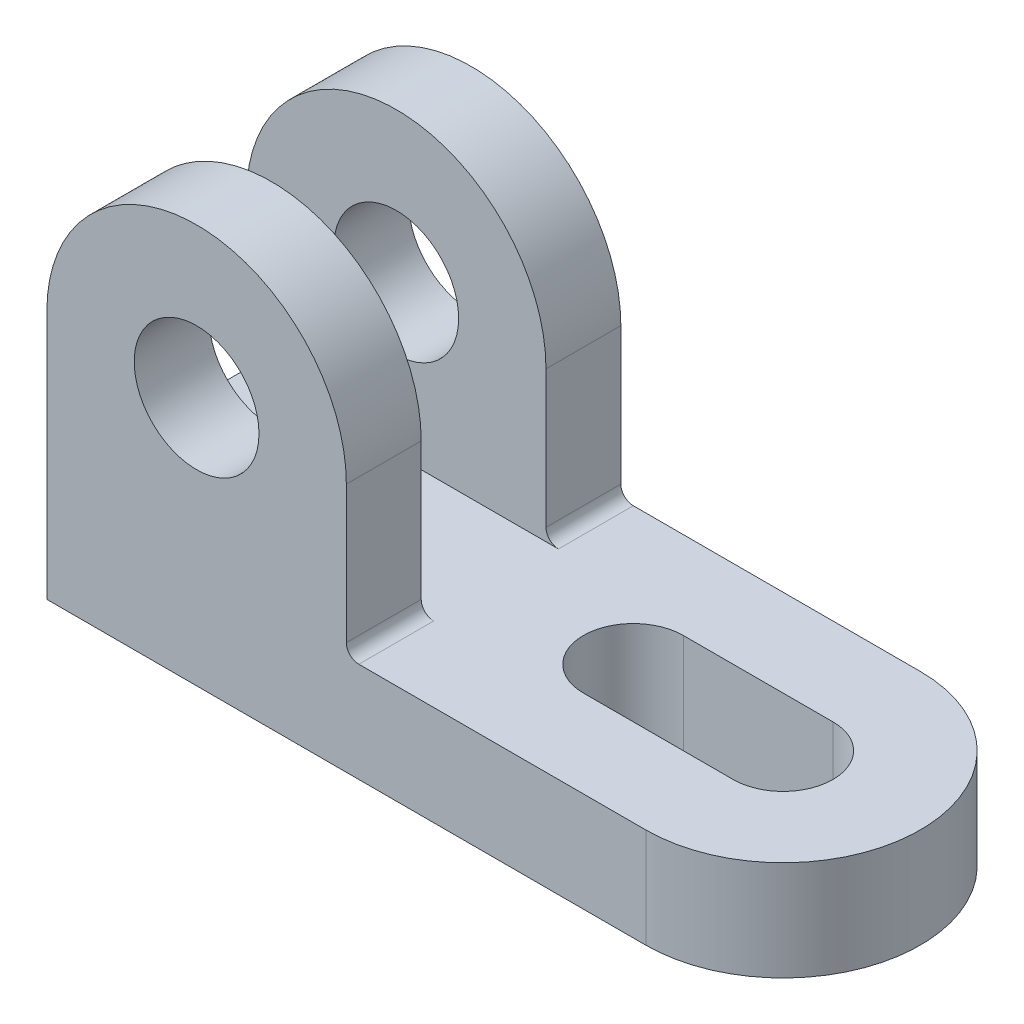
from build123d import *

# Parameters (mm, degrees)
SKETCH1_R           = 22
BOSS_EXTRUDE2_DEPTH = 16
BOSS_EXTRUDE3_DEPTH = 12
CUT_EXTRUDE1_DEPTH  = 16
FILLET1_R           = 2


with BuildPart() as part:
    # Sketch1 → Boss-Extrude2 (new body)
    with BuildSketch(Plane(origin=(0, 0, 0), x_dir=(1, 0, 0), z_dir=(0, 1, 0))):
        with BuildLine():
            Line((37.000000064, 22), (-59, 22))
            Line((-59, 22), (-59, -22))
            Line((-59, -22), (37, -22))
            ThreePointArc((37, -22), (15, 3.2e-08), (37.000000064, 22))
        make_face()
        with Locations((37, 0)):
            Circle(SKETCH1_R)
    extrude(amount=BOSS_EXTRUDE2_DEPTH)

    # Sketch2 → Boss-Extrude3 (add)
    with BuildSketch(Plane.XY.offset(22)):
        with BuildLine():
            ThreePointArc((-11, 40), (-18.029437252, 23.029437252), (-35, 16))
            Line((-35, 16), (-11, 16))
            Line((-11, 16), (-11, 40))
        make_face()
        with BuildLine():
            Line((-59, 40), (-59, 16))
            Line((-59, 16), (-35, 16))
            ThreePointArc((-35, 16), (-51.970562748, 23.029437252), (-59, 40))
        make_face()
        with BuildLine():
            ThreePointArc((-59, 40), (-51.970562748, 23.029437252), (-35, 16))
            ThreePointArc((-35, 16), (-18.029437252, 23.029437252), (-11, 40))
            Line((-11, 40), (-25, 40))
            ThreePointArc((-25, 40), (-35, 30), (-45, 40))
            Line((-45, 40), (-59, 40))
        make_face()
        with BuildLine():
            ThreePointArc((-11, 40), (-35, 64), (-59, 40))
            Line((-59, 40), (-45, 40))
            ThreePointArc((-45, 40), (-35, 50), (-25, 40))
            Line((-25, 40), (-11, 40))
        make_face()
    boss_extrude3 = extrude(amount=-BOSS_EXTRUDE3_DEPTH)

    # Mirror1: Boss-Extrude3 across plane
    add(boss_extrude3.mirror(Plane.XY))

    # Sketch3 → Cut-Extrude1 (cut)
    with BuildSketch(Plane(origin=(0, 16, 0), x_dir=(1, 0, 0), z_dir=(0, 1, 0))):
        with BuildLine():
            Line((13, 8), (37, 8))
            ThreePointArc((37, 8), (45, 0), (37, -8))
            Line((37, -8), (13, -8))
            ThreePointArc((13, -8), (5, 0), (13, 8))
        make_face()
    extrude(amount=-CUT_EXTRUDE1_DEPTH, mode=Mode.SUBTRACT)

    # Fillet1
    fillet1_edges = [part.edges().sort_by_distance(p)[0] for p in [
        (-11, 16, 16),
        (-11, 16, -16),
    ]]
    fillet(fillet1_edges, radius=FILLET1_R)


solid = part.part
